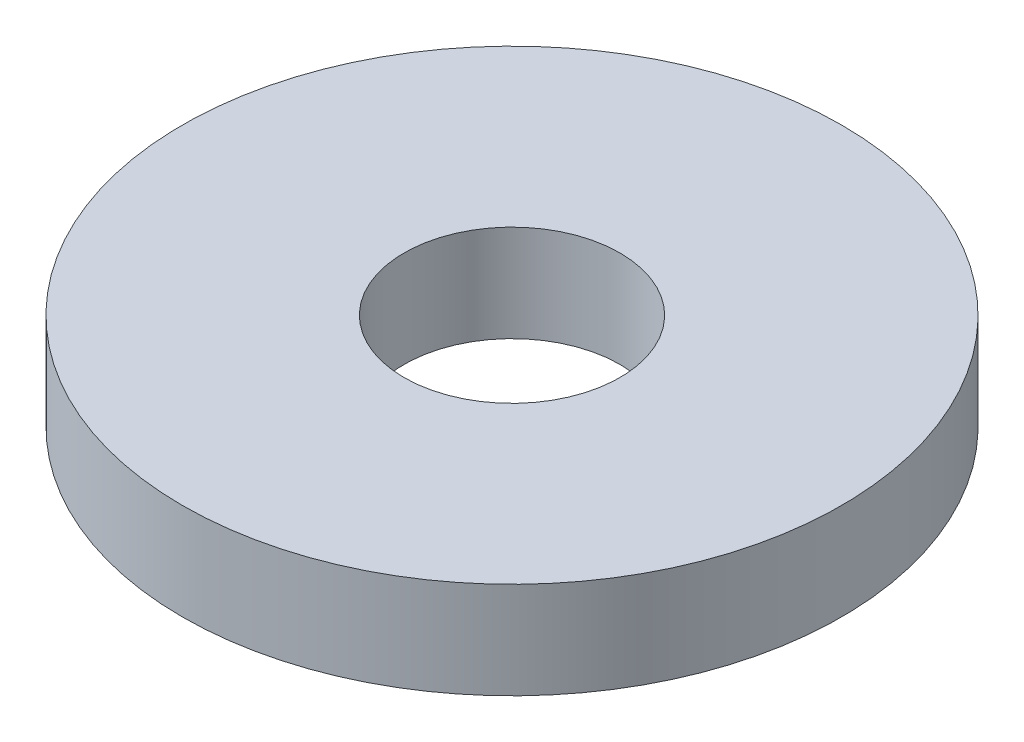
from build123d import *

# Parameters (mm, degrees)
SKETCH1_R           = 10.3124
BOSS_EXTRUDE1_DEPTH = 3.0226
SKETCH5_R           = 3.3782
CUT_EXTRUDE1_DEPTH  = 15.893867808


with BuildPart() as part:
    # Sketch1 → Boss-Extrude1 (new body)
    with BuildSketch(Plane(origin=(0, 0, 0), x_dir=(1, 0, 0), z_dir=(0, 1, 0))):
        with Locations(Location((0, 0, 0), (0, 0, 270))):
            Circle(SKETCH1_R)
    extrude(amount=BOSS_EXTRUDE1_DEPTH)

    # Sketch5 → Cut-Extrude1 (cut, through all)
    with BuildSketch(Plane(origin=(0, 3.0226, 0), x_dir=(-1, 0, 0), z_dir=(0, 1, 0))):
        with Locations(Location((0, 0, 0), (0, 0, 90))):
            Circle(SKETCH5_R)
    extrude(amount=-CUT_EXTRUDE1_DEPTH, mode=Mode.SUBTRACT)


solid = part.part
